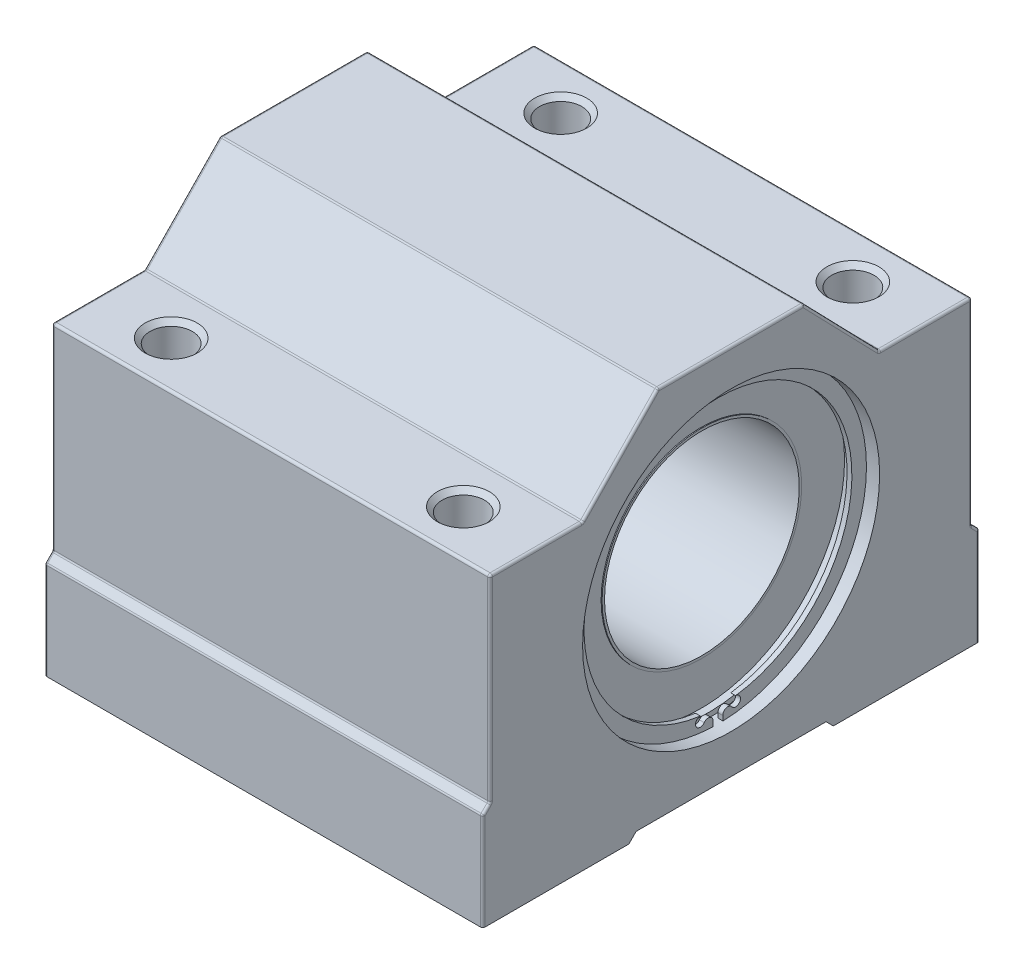
from build123d import *

# Parameters (mm, degrees)
SKETCH1_R           = 30.5
BOSS_EXTRUDE1_DEPTH = 90
EXTRUDE_THIN1_START = 0.5
SKETCH1_4_R         = 20.5
SKETCH1_4_R_2       = 20
EXTRUDE_THIN1_DEPTH = 83.5
BOSS_EXTRUDE2_START = 0.8
SKETCH1_5_R         = 29.5
SKETCH1_5_R_2       = 20
BOSS_EXTRUDE2_DEPTH = 83
BOSS_EXTRUDE3_START = 0.3
SKETCH1_6_R         = 30.5
SKETCH1_6_R_2       = 29.5
BOSS_EXTRUDE3_DEPTH = 85
BOSS_EXTRUDE4_START = 1
BOSS_EXTRUDE4_DEPTH = 1
FILLET1_R           = 0.5
SKETCH4_R           = 4.35
CUT_EXTRUDE3_DEPTH  = 130.55693729
CHAMFER1_SIZE       = 1


with BuildPart() as part:
    # Sketch1 → Boss-Extrude1 (new body)
    with BuildSketch(Plane(origin=(0, 0, 0), x_dir=(0, 0, -1), z_dir=(1, 0, 0))):
        Polygon((-51, -40), (-21, -40), (-19.5, -38.5), (19.5, -38.5), (21, -40), (51, -40), (51, -20), (49.5, -18.5), (49.5, 22), (30.5, 22), (15, 38), (-15, 38), (-30.5, 22), (-49.5, 22), (-49.5, -18.5), (-51, -20), align=None)
        Circle(SKETCH1_R, mode=Mode.SUBTRACT)
    extrude(amount=BOSS_EXTRUDE1_DEPTH)



with BuildPart() as body_2:
    # Sketch1<4> → Extrude-Thin1 (new body)
    with BuildSketch(Plane(origin=(0, 0, 0), x_dir=(0, 0, -1), z_dir=(1, 0, 0)).offset(EXTRUDE_THIN1_START)):
        Circle(SKETCH1_4_R)
        Circle(SKETCH1_4_R_2, mode=Mode.SUBTRACT)
    extrude(amount=EXTRUDE_THIN1_DEPTH)

    # Sketch1<5> → Boss-Extrude2 (add)
    with BuildSketch(Plane(origin=(0, 0, 0), x_dir=(0, 0, -1), z_dir=(1, 0, 0)).offset(BOSS_EXTRUDE2_START)):
        Circle(SKETCH1_5_R)
        Circle(SKETCH1_5_R_2, mode=Mode.SUBTRACT)
    extrude(amount=BOSS_EXTRUDE2_DEPTH)


with BuildPart() as part_1:
    add(part.part)

    add(body_2.part)  # Boss-Extrude3 merges body 2
    # Sketch1<6> → Boss-Extrude3 (add)
    with BuildSketch(Plane(origin=(0, 0, 0), x_dir=(0, 0, -1), z_dir=(1, 0, 0)).offset(BOSS_EXTRUDE3_START)):
        Circle(SKETCH1_6_R)
        Circle(SKETCH1_6_R_2, mode=Mode.SUBTRACT)
    extrude(amount=BOSS_EXTRUDE3_DEPTH)

    # Sketch3 → Boss-Extrude4 (add)
    with BuildSketch(Plane(origin=(85.3, 0, 0), x_dir=(0, 0, -1), z_dir=(1, 0, 0)).offset(BOSS_EXTRUDE4_START)):
        with BuildLine():
            Line((-1.001295059, -29.483002022), (-1.035237264, -30.482425819))
            ThreePointArc((-1.035237264, -30.482425819), (0, 30.5), (1.035237264, -30.482425819))
            Line((1.035237264, -30.482425819), (1.001295059, -29.483002022))
            ThreePointArc((1.001295059, -29.483002022), (1.67030528, -28.488037708), (2.813261111, -28.850226376))
            ThreePointArc((2.813261111, -28.850226376), (4.517048294, -28.723259657), (3.621379804, -27.268340668))
            ThreePointArc((3.621379804, -27.268340668), (0, 27.507758805), (-3.621379804, -27.268340668))
            ThreePointArc((-3.621379804, -27.268340668), (-4.517048294, -28.723259657), (-2.813261111, -28.850226376))
            ThreePointArc((-2.813261111, -28.850226376), (-1.67030528, -28.488037708), (-1.001295059, -29.483002022))
        make_face()
    extrude(amount=BOSS_EXTRUDE4_DEPTH)

    # Fillet1
    fillet1_edges = [part_1.edges().sort_by_distance(p)[0] for p in [
        (45, -18.5, -49.5),
        (45, -18.5, 49.5),
        (45, -20, 51),
        (45, -20, -51),
        (45, 22, -30.5),
        (45, 22, 30.5),
        (45, 38, 15),
        (45, 38, -15),
        (45, 22, -49.5),
        (45, 22, 49.5),
        (90, 30, -22.75),
        (90, 30, 22.75),
        (90, 1.75, 49.5),
        (0, -19.25, 50.25),
        (0, 30, 22.75),
        (90, -19.25, -50.25),
        (90, -30, -51),
        (90, 1.75, -49.5),
        (90, 38, 0),
        (90, 22, -40),
        (90, 22, 40),
        (90, -19.25, 50.25),
        (90, -30, 51),
        (0, -30, -51),
        (0, -19.25, -50.25),
        (0, 1.75, -49.5),
        (0, 30, -22.75),
        (0, 22, -40),
        (0, 38, 0),
        (0, -30, 51),
        (0, 1.75, 49.5),
        (0, 22, 40),
    ]]
    fillet(fillet1_edges, radius=FILLET1_R)

    # Sketch4 → Cut-Extrude3 (cut, through all)
    with BuildSketch(Plane.XZ.offset(40)):
        with Locations((15, 40)):
            Circle(SKETCH4_R)
        with Locations((75, 40)):
            Circle(SKETCH4_R)
        with Locations((75, -40)):
            Circle(SKETCH4_R)
        with Locations((15, -40)):
            Circle(SKETCH4_R)
    extrude(amount=-CUT_EXTRUDE3_DEPTH, mode=Mode.SUBTRACT)

    # Chamfer1
    chamfer1_edges = [part_1.edges().sort_by_distance(p)[0] for p in [
        (70.65, 22, -40),
        (10.65, 22, -40),
        (10.65, 22, 40),
        (70.65, 22, 40),
        (70.65, -40, 40),
        (10.65, -40, 40),
    ]]
    chamfer(chamfer1_edges, length=CHAMFER1_SIZE)


solid = part_1.part
